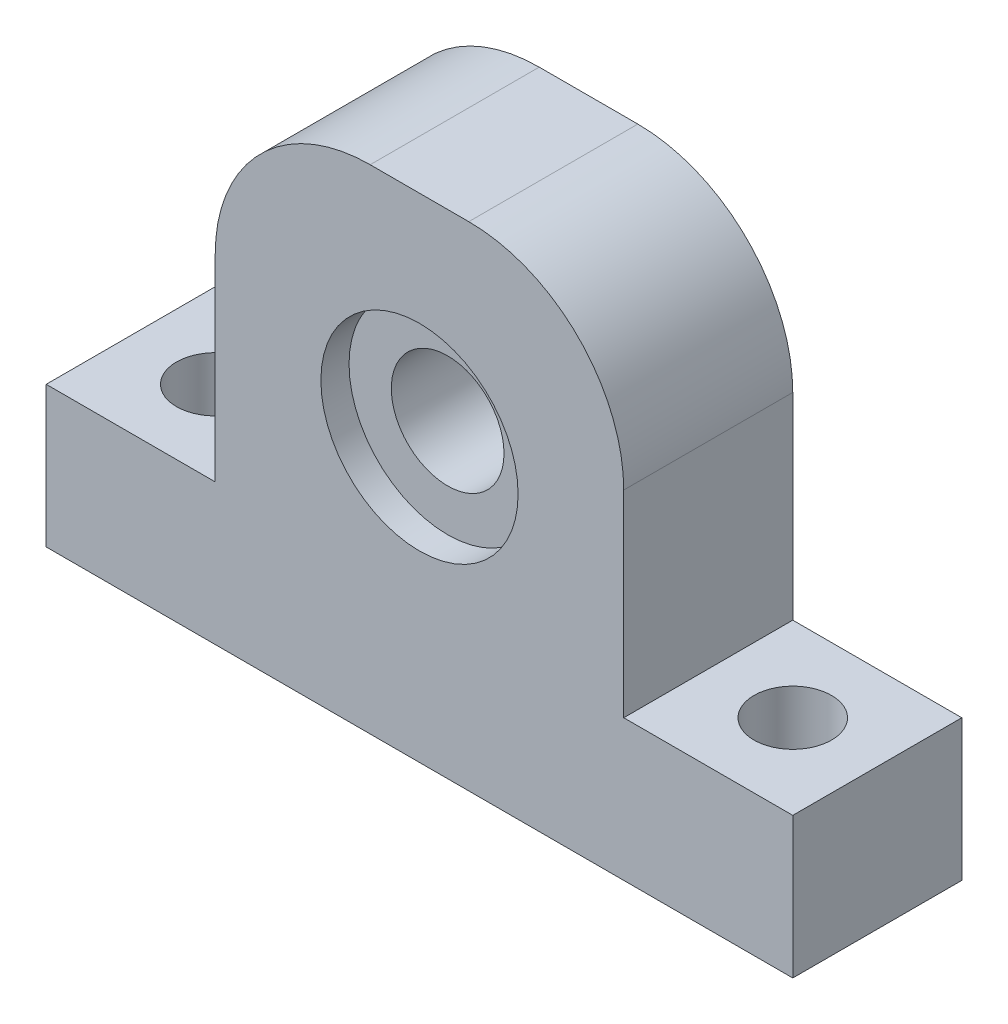
from build123d import *

# Parameters (mm, degrees)
EXTRUDE_1_DEPTH      = 6
EXTRUDE_1_DEPTH_BACK = 6
SKETCH_1_R           = 4
SKETCH_2_R           = 7
CUT_EXTRUDE_1_DEPTH  = 2
CUT_EXTRUDE_START    = -2
SKETCH_3_R           = 7
CUT_EXTRUDE_2_DEPTH  = 2
SKETCH_4_R           = 2.75
CUT_EXTRUDE_3_DEPTH  = 17


with BuildPart() as part:
    # 草图1 → 凸台-拉伸1 (new, two sides: drawn at the far end of the back side and taken through both)
    with BuildSketch(Plane.XY.offset(-EXTRUDE_1_DEPTH_BACK)):
        with BuildLine():
            Line((3.5, 15), (-3.5, 15))
            ThreePointArc((-3.5, 15), (-11.278174593, 11.778174593), (-14.5, 4))
            Line((-14.5, 4), (-14.5, -10))
            Line((-14.5, -10), (-26.5, -10))
            Line((-26.5, -10), (-26.5, -20))
            Line((-26.5, -20), (26.5, -20))
            Line((26.5, -20), (26.5, -10))
            Line((26.5, -10), (14.5, -10))
            Line((14.5, -10), (14.5, 4))
            ThreePointArc((14.5, 4), (11.278174593, 11.778174593), (3.5, 15))
        make_face()
        Circle(SKETCH_1_R, mode=Mode.SUBTRACT)
    extrude(amount=EXTRUDE_1_DEPTH + EXTRUDE_1_DEPTH_BACK)

    # 草图2 → 切除-拉伸1 (cut)
    with BuildSketch(Plane.XY.offset(6)):
        Circle(SKETCH_2_R)
    extrude(amount=-CUT_EXTRUDE_1_DEPTH, mode=Mode.SUBTRACT)

    # 草图3 → 切除-拉伸2 (cut)
    with BuildSketch(Plane(origin=(0, 0, -6), x_dir=(-1, 0, 0), z_dir=(0, 0, -1)).offset(CUT_EXTRUDE_START)):
        Circle(SKETCH_3_R)
    extrude(amount=CUT_EXTRUDE_2_DEPTH, mode=Mode.SUBTRACT)

    # 草图4 → 切除-拉伸3 (cut)
    with BuildSketch(Plane.XZ.offset(20)):
        with Locations((-20.5, 0)):
            Circle(SKETCH_4_R)
        with Locations((20.5, 0)):
            Circle(SKETCH_4_R)
    extrude(amount=-CUT_EXTRUDE_3_DEPTH, mode=Mode.SUBTRACT)


solid = part.part
